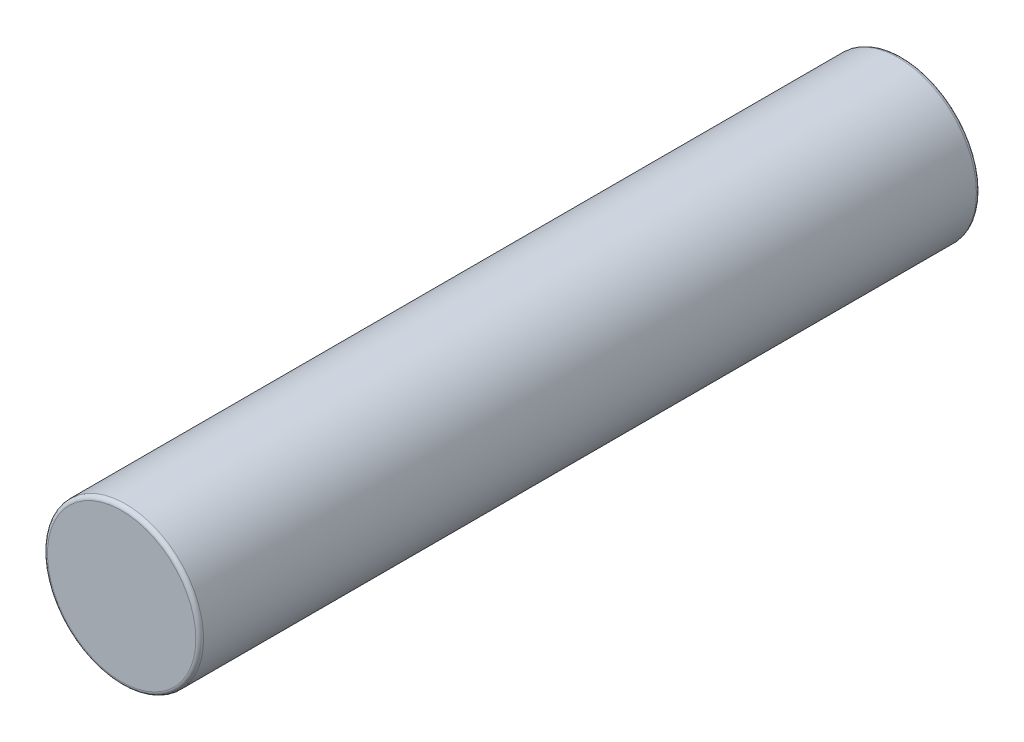
from build123d import *

# Parameters (mm, degrees)
SKETCH1_R           = 20
BOSS_EXTRUDE1_DEPTH = 200
FILLET1_R           = 1


with BuildPart() as part:
    # Sketch1 → Boss-Extrude1 (new body)
    with BuildSketch(Plane.XY):
        Circle(SKETCH1_R)
    extrude(amount=BOSS_EXTRUDE1_DEPTH)

    # Fillet1
    fillet1_edges = [part.edges().sort_by_distance(p)[0] for p in [
        (-20, 0, 0),
        (-20, 0, 200),
    ]]
    fillet(fillet1_edges, radius=FILLET1_R)


solid = part.part
